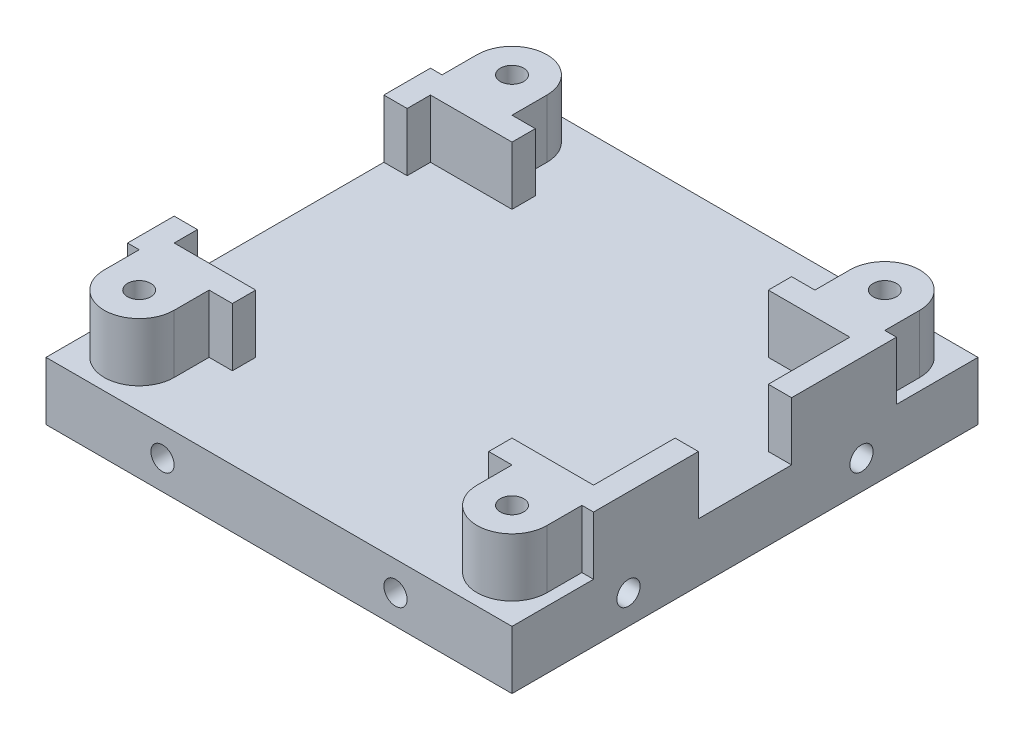
from build123d import *
from build123d.topology import SkipClean

# Parameters (mm, degrees)
SKETCH1_W           = 40
SKETCH1_H           = 40
BOSS_EXTRUDE1_DEPTH = 5
SKETCH3_R           = 1
BOSS_EXTRUDE3_DEPTH = 5
SKETCH3_4_R         = 1
CUT_EXTRUDE1_DEPTH  = 5
SKETCH4_R           = 1
CUT_EXTRUDE2_DEPTH  = 10
CIRPATTERN2_COUNT   = 4


with BuildPart() as part:
    # Sketch1 → Boss-Extrude1 (new body)
    with BuildSketch(Plane(origin=(0, 0, 0), x_dir=(1, 0, 0), z_dir=(0, 1, 0))):
        Rectangle(SKETCH1_W, SKETCH1_H)
    extrude(amount=BOSS_EXTRUDE1_DEPTH)

    # Sketch3 → Boss-Extrude3 (add)
    # profile 1 of 4: a face of its own
    with BuildSketch(Plane(origin=(0, 5, 0), x_dir=(1, 0, 0), z_dir=(0, 1, 0))):
        with BuildLine():
            Line((11, 11), (18, 11))
            Line((18, 11), (18, 4))
            Line((18, 4), (20, 4))
            Line((20, 4), (20, 13))
            Line((20, 13), (19, 13))
            Line((19, 13), (19, 16))
            ThreePointArc((19, 16), (16, 19), (13, 16))
            Line((13, 16), (13, 13))
            Line((13, 13), (11, 13))
            Line((11, 13), (11, 11))
        make_face()
        with Locations((16, 16)):
            Circle(SKETCH3_R, mode=Mode.SUBTRACT)
    # profile 2 of 4: a face of its own
    with BuildSketch(Plane(origin=(0, 5, 0), x_dir=(1, 0, 0), z_dir=(0, 1, 0))):
        with BuildLine():
            Line((-18, 11), (-11, 11))
            Line((-11, 11), (-11, 13))
            Line((-11, 13), (-13, 13))
            Line((-13, 13), (-13, 16))
            ThreePointArc((-13, 16), (-16, 19), (-19, 16))
            Line((-19, 16), (-19, 13))
            Line((-19, 13), (-20, 13))
            Line((-20, 13), (-20, 9))
            Line((-20, 9), (-18, 9))
            Line((-18, 9), (-18, 11))
        make_face()
        with BuildLine():
            ThreePointArc((-17, 16), (-16, 17), (-15, 16))
            Line((-15, 16), (-17, 16))
        make_face(mode=Mode.SUBTRACT)
    # profile 3 of 4: a face of its own
    with BuildSketch(Plane(origin=(0, 5, 0), x_dir=(1, 0, 0), z_dir=(0, 1, 0))):
        with BuildLine():
            Line((20, -4), (18, -4))
            Line((18, -4), (18, -11))
            Line((18, -11), (11, -11))
            Line((11, -11), (11, -13))
            Line((11, -13), (13, -13))
            Line((13, -13), (13, -16))
            ThreePointArc((13, -16), (16, -19), (19, -16))
            Line((19, -16), (19, -13))
            Line((19, -13), (20, -13))
            Line((20, -13), (20, -4))
        make_face()
    # profile 4 of 4: a face of its own
    with BuildSketch(Plane(origin=(0, 5, 0), x_dir=(1, 0, 0), z_dir=(0, 1, 0))):
        with BuildLine():
            Line((-11, -13), (-11, -11))
            Line((-11, -11), (-18, -11))
            Line((-18, -11), (-18, -9))
            Line((-18, -9), (-20, -9))
            Line((-20, -9), (-20, -13))
            Line((-20, -13), (-19, -13))
            Line((-19, -13), (-19, -16))
            ThreePointArc((-19, -16), (-16, -19), (-13, -16))
            Line((-13, -16), (-13, -13))
            Line((-13, -13), (-11, -13))
        make_face()
        with BuildLine():
            ThreePointArc((-15, -16), (-16, -17), (-17, -16))
            Line((-17, -16), (-15, -16))
        make_face(mode=Mode.SUBTRACT)
    extrude(amount=BOSS_EXTRUDE3_DEPTH)

    # Sketch3<4> → Cut-Extrude1 (cut)
    with SkipClean():  # the faces are left unmerged after this step: merging them gives an invalid solid
        with BuildSketch(Plane(origin=(0, 5, 0), x_dir=(1, 0, 0), z_dir=(0, 1, 0))):
            with Locations((-16, 16)):
                Circle(SKETCH3_4_R)
            with Locations((-16, -16)):
                Circle(SKETCH3_4_R)
            with Locations((16, -16)):
                Circle(SKETCH3_4_R)
        extrude(amount=CUT_EXTRUDE1_DEPTH, mode=Mode.SUBTRACT)

    # Sketch4 → Cut-Extrude2 (cut)
    with SkipClean():  # the faces are left unmerged after this step: merging them gives an invalid solid
        with BuildSketch(Plane.ZY.offset(20)):
            with Locations((-10, 2.5)):
                Circle(SKETCH4_R)
            with Locations((10, 2.5)):
                Circle(SKETCH4_R)
        cut_extrude2 = extrude(amount=-CUT_EXTRUDE2_DEPTH, mode=Mode.SUBTRACT)

    # CirPattern2: Cut-Extrude2 ×4 about axis
    with SkipClean():  # the faces are left unmerged after this step: merging them gives an invalid solid
        cirpattern2_axis = Axis((0, 0, 0), (0, -1, 0))
        for i in range(1, CIRPATTERN2_COUNT):
            add(cut_extrude2.rotate(cirpattern2_axis, i * 360 / CIRPATTERN2_COUNT), mode=Mode.SUBTRACT)


solid = part.part
